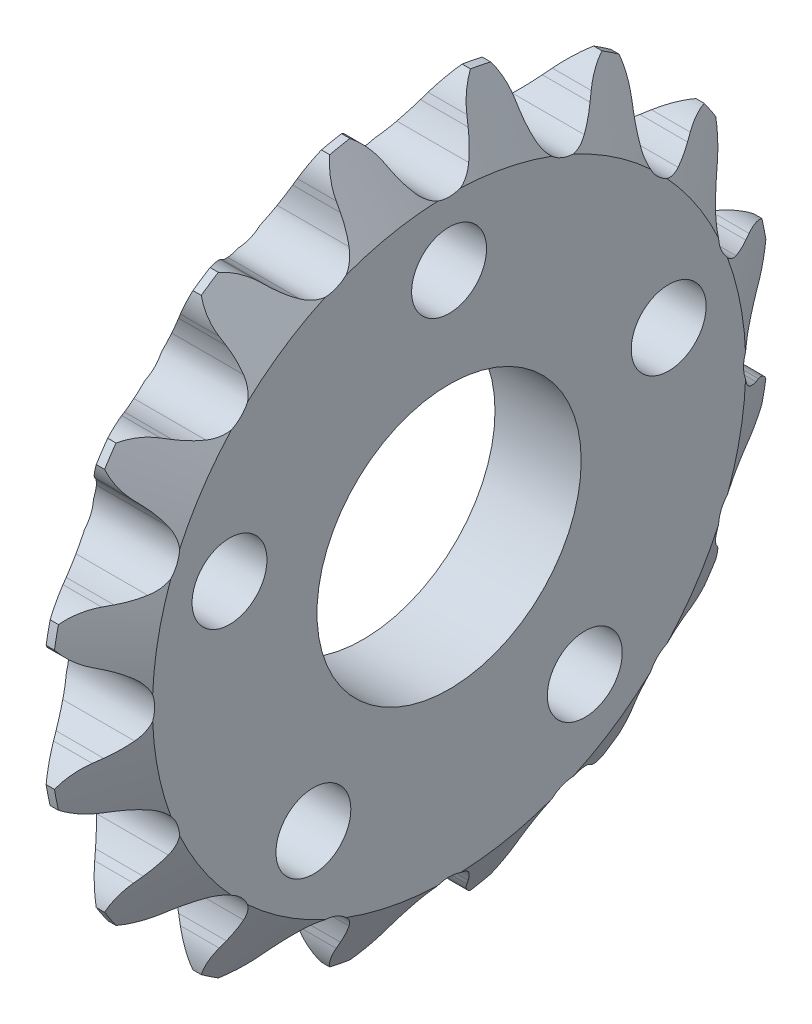
from build123d import *

# Parameters (mm, degrees)
CUT_EXTRUDE1_DEPTH = 26.350646391
CIRPATTERN1_COUNT  = 16
SKETCH4_R          = 6.5405
SKETCH4_R_2        = 1.8542
CUT_EXTRUDE2_DEPTH = 26.268696487


with BuildPart() as part:
    # Sketch2 → Revolve1 (revolve)
    with BuildSketch(Plane.XY):
        Polygon((-0.206375, 17.862013093), (0.206375, 17.862013093), (2.1336, 14.687013093), (2.1336, 0), (-2.1336, 0), (-2.1336, 14.687013093), align=None)
    revolve(axis=Axis((-2.1336, 0, 0), (1, 0, 0)))

    # Sketch3 → Cut-Extrude1 (cut, symmetric)
    with BuildSketch(Plane(origin=(0, 0, 0), x_dir=(0, 0, -1), z_dir=(1, 0, 0))):
        with BuildLine():
            Line((-2.051408678, 16.490963774), (-1.895951627, 16.145861918))
            ThreePointArc((-1.895951627, 16.145861918), (-1.639424454, 15.660854777), (-1.323740827, 15.212098758))
            ThreePointArc((-1.323740827, 15.212098758), (0, 14.577158093), (1.323740827, 15.212098758))
            ThreePointArc((1.323740827, 15.212098758), (1.639424454, 15.660854777), (1.895951627, 16.145861918))
            Line((1.895951627, 16.145861918), (2.051408678, 16.490963774))
            ThreePointArc((2.051408678, 16.490963774), (2.666228008, 17.353882105), (3.563871438, 17.916791625))
            ThreePointArc((3.563871438, 17.916791625), (0, 18.267802324), (-3.563871438, 17.916791625))
            ThreePointArc((-3.563871438, 17.916791625), (-2.666228008, 17.353882105), (-2.051408678, 16.490963774))
        make_face()
    cut_extrude1 = extrude(amount=CUT_EXTRUDE1_DEPTH, both=True, mode=Mode.SUBTRACT)

    # CirPattern1: Cut-Extrude1 ×16 about axis
    cirpattern1_axis = Axis((-88.99, 0, 0), (1, 0, 0))
    for i in range(1, CIRPATTERN1_COUNT):
        add(cut_extrude1.rotate(cirpattern1_axis, i * 360 / CIRPATTERN1_COUNT), mode=Mode.SUBTRACT)

    # Sketch4 → Cut-Extrude2 (cut, through all)
    with BuildSketch(Plane(origin=(2.1336, 0, 0), x_dir=(0, 0, -1), z_dir=(1, 0, 0))):
        Circle(SKETCH4_R)
        with Locations((0, 11.43)):
            Circle(SKETCH4_R_2)
        with Locations((10.870575981, 3.532064246)):
            Circle(SKETCH4_R_2)
        with Locations((6.718385434, -9.247064246)):
            Circle(SKETCH4_R_2)
        with Locations((-6.718385434, -9.247064246)):
            Circle(SKETCH4_R_2)
        with Locations((-10.870575981, 3.532064246)):
            Circle(SKETCH4_R_2)
    extrude(amount=-CUT_EXTRUDE2_DEPTH, mode=Mode.SUBTRACT)


solid = part.part
